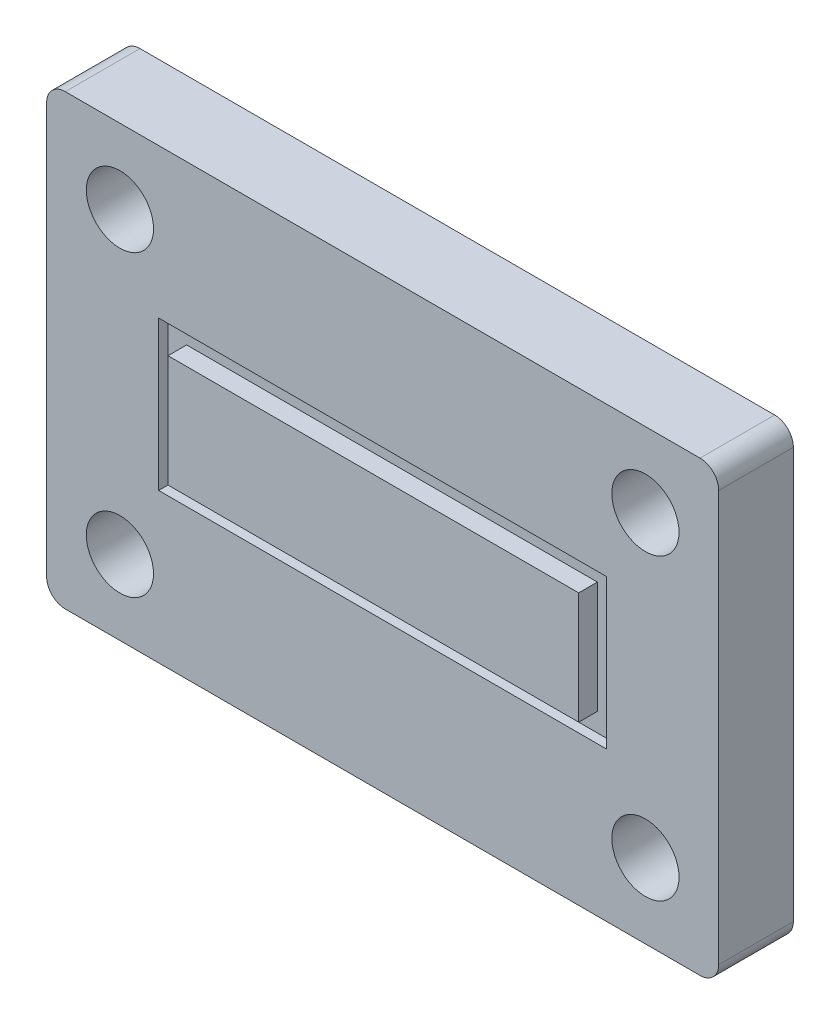
from build123d import *

# Parameters (mm, degrees)
SKETCH1_W                = 36
SKETCH1_H                = 24
BOSS_EXTRUDE1_DEPTH      = 4
M3_CLEARANCE_HOLE1_D     = 3.6
M3_CLEARANCE_HOLE1_DEPTH = 16
M3_CLEARANCE_HOLE1_TIP   = 1.081549114
FILLET1_R                = 1
SKETCH4_W                = 24
SKETCH4_H                = 8
CUT_EXTRUDE1_DEPTH       = 0.5
SKETCH5_W                = 22
SKETCH5_H                = 6
BOSS_EXTRUDE2_DEPTH      = 1


with BuildPart() as part:
    # Sketch1 → Boss-Extrude1 (new body)
    with BuildSketch(Plane.XY):
        with Locations((18, 12)):
            Rectangle(SKETCH1_W, SKETCH1_H)
    extrude(amount=BOSS_EXTRUDE1_DEPTH)

    # M3 Clearance Hole1
    with Locations(Plane.XY.offset(4)):
        with Locations((3.925, 20), (32.075, 20), (32.075, 4), (3.925, 4)):
            Hole(M3_CLEARANCE_HOLE1_D / 2, depth=M3_CLEARANCE_HOLE1_DEPTH)
            with Locations((0, 0, -(M3_CLEARANCE_HOLE1_DEPTH + M3_CLEARANCE_HOLE1_TIP / 2))):  # 118° drill point
                Cone(0, M3_CLEARANCE_HOLE1_D / 2, M3_CLEARANCE_HOLE1_TIP, mode=Mode.SUBTRACT)

    # Fillet1
    fillet1_edges = [part.edges().sort_by_distance(p)[0] for p in [
        (0, 24, 2),
        (36, 24, 2),
        (36, 0, 2),
        (0, 0, 2),
    ]]
    fillet(fillet1_edges, radius=FILLET1_R)

    # Sketch4 → Cut-Extrude1 (cut)
    with BuildSketch(Plane.XY.offset(4)):
        with Locations((18, 12)):
            Rectangle(SKETCH4_W, SKETCH4_H)
    extrude(amount=-CUT_EXTRUDE1_DEPTH, mode=Mode.SUBTRACT)


with BuildPart() as body_2:
    # Sketch5 → Boss-Extrude2 (new body)
    with BuildSketch(Plane.XY.offset(3.5)):
        with Locations((18, 12)):
            Rectangle(SKETCH5_W, SKETCH5_H)
    extrude(amount=BOSS_EXTRUDE2_DEPTH)


solid = Compound([part.part, body_2.part])
